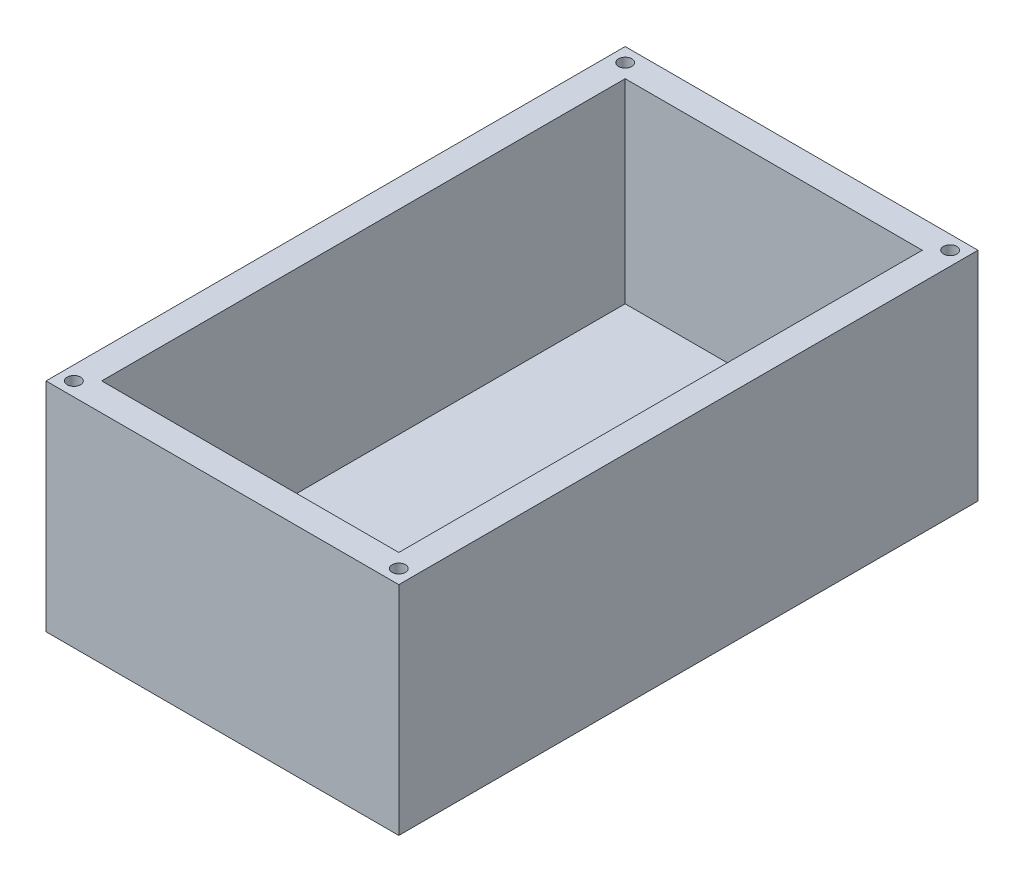
from build123d import *

# Parameters (mm, degrees)
SCHIZZO1_W                   = 63.34
SCHIZZO1_H                   = 103.98
ESTRUSIONE_ESTRUSIONE1_DEPTH = 4
SCHIZZO2_W                   = 63.34
SCHIZZO2_H                   = 103.98
SCHIZZO2_W_2                 = 53.34
SCHIZZO2_H_2                 = 93.98
ESTRUSIONE_ESTRUSIONE2_DEPTH = 35
FORO_PER_VITE_M2_1_D         = 2.4


with BuildPart() as part:
    # Schizzo1 → Estrusione-Estrusione1 (new body)
    with BuildSketch(Plane(origin=(0, 0, 0), x_dir=(1, 0, 0), z_dir=(0, 1, 0))):
        with Locations((34.160538922, 55.414491018)):
            Rectangle(SCHIZZO1_W, SCHIZZO1_H)
    extrude(amount=ESTRUSIONE_ESTRUSIONE1_DEPTH)

    # Schizzo2 → Estrusione-Estrusione2 (add)
    with BuildSketch(Plane(origin=(0, 4, 0), x_dir=(1, 0, 0), z_dir=(0, 1, 0))):
        with Locations((34.160538922, 55.414491018)):
            Rectangle(SCHIZZO2_W, SCHIZZO2_H)
        with Locations((34.160538922, 55.414491018)):
            Rectangle(SCHIZZO2_W_2, SCHIZZO2_H_2, mode=Mode.SUBTRACT)
    extrude(amount=ESTRUSIONE_ESTRUSIONE2_DEPTH)

    # Foro per Vite M2-1 (through all)
    with Locations(Plane(origin=(0, 39, 0), x_dir=(1, 0, 0), z_dir=(0, 1, 0))):
        with Locations((4.990538922, 104.904491018), (63.330538922, 104.904491018), (63.330538922, 5.924491018), (4.990538922, 5.924491018)):
            Hole(FORO_PER_VITE_M2_1_D / 2)


solid = part.part
